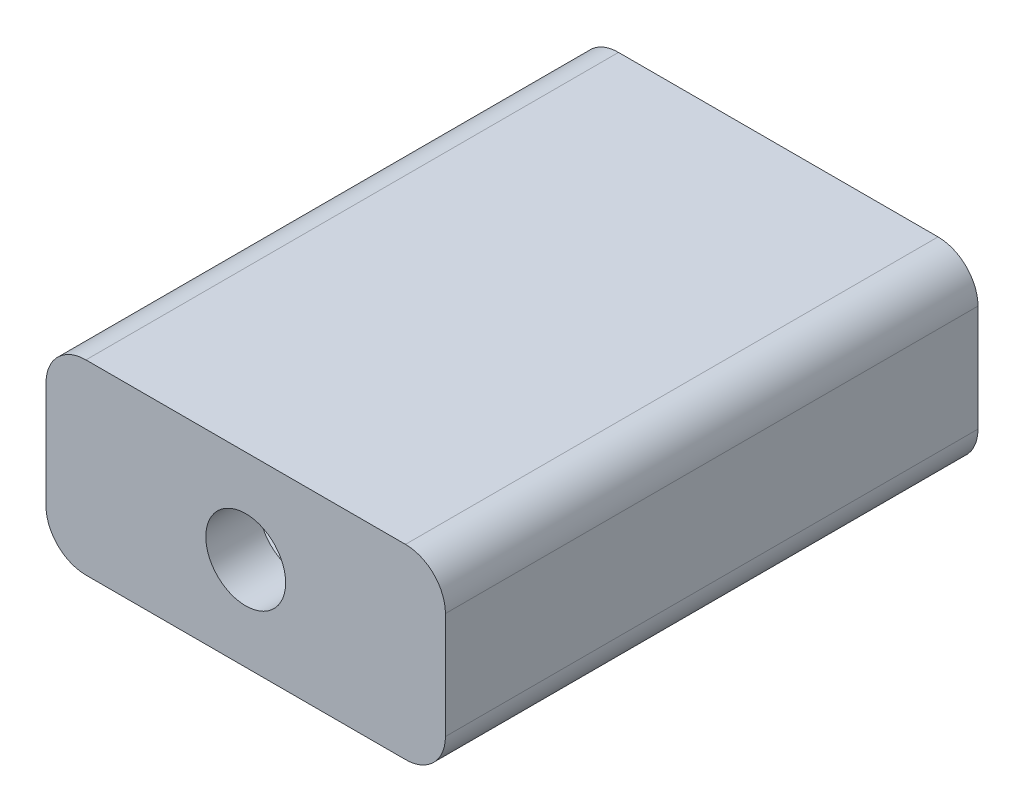
from build123d import *

# Parameters (mm, degrees)
BOSS_EXTRUDE1_DEPTH = 40
SKETCH2_W           = 24.6
SKETCH2_H           = 9
CUT_EXTRUDE1_DEPTH  = 36
SKETCH3_R           = 3
CUT_EXTRUDE2_DEPTH  = 4.5


with BuildPart() as part:
    # Sketch1 → Boss-Extrude1 (new body)
    with BuildSketch(Plane.XY):
        with BuildLine():
            Line((-12, -7), (12, -7))
            ThreePointArc((12, -7), (14.121320344, -6.121320344), (15, -4))
            Line((15, -4), (15, 4))
            ThreePointArc((15, 4), (14.121320344, 6.121320344), (12, 7))
            Line((12, 7), (-12, 7))
            ThreePointArc((-12, 7), (-14.121320344, 6.121320344), (-15, 4))
            Line((-15, 4), (-15, -4))
            ThreePointArc((-15, -4), (-14.121320344, -6.121320344), (-12, -7))
        make_face()
    extrude(amount=BOSS_EXTRUDE1_DEPTH)

    # Sketch2 → Cut-Extrude1 (cut)
    with BuildSketch(Plane(origin=(0, 0, 0), x_dir=(-1, 0, 0), z_dir=(0, 0, -1))):
        Rectangle(SKETCH2_W, SKETCH2_H)
    extrude(amount=-CUT_EXTRUDE1_DEPTH, mode=Mode.SUBTRACT)

    # Sketch3 → Cut-Extrude2 (cut)
    with BuildSketch(Plane.XY.offset(40)):
        Circle(SKETCH3_R)
    extrude(amount=-CUT_EXTRUDE2_DEPTH, mode=Mode.SUBTRACT)


solid = part.part
